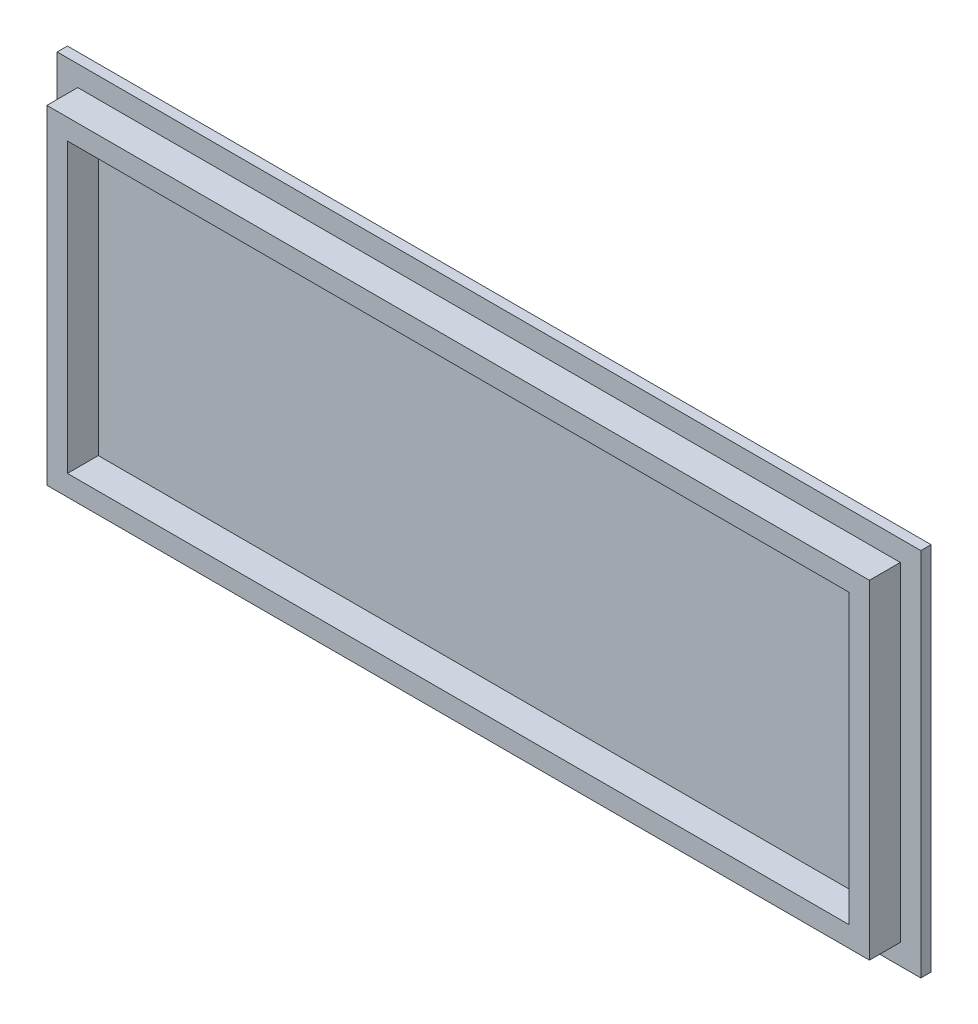
from build123d import *

# Parameters (mm, degrees)
SKETCH1_W           = 84
SKETCH1_H           = 36
BOSS_EXTRUDE1_DEPTH = 1
SKETCH2_W           = 80
SKETCH2_H           = 32
SKETCH2_W_2         = 76
SKETCH2_H_2         = 28
BOSS_EXTRUDE2_DEPTH = 3


with BuildPart() as part:
    # Sketch1 → Boss-Extrude1 (new body)
    with BuildSketch(Plane.XY):
        with Locations((42, 18)):
            Rectangle(SKETCH1_W, SKETCH1_H)
    extrude(amount=BOSS_EXTRUDE1_DEPTH)

    # Sketch2 → Boss-Extrude2 (add)
    with BuildSketch(Plane.XY.offset(1)):
        with Locations((42, 18)):
            Rectangle(SKETCH2_W, SKETCH2_H)
        with Locations((42, 18)):
            Rectangle(SKETCH2_W_2, SKETCH2_H_2, mode=Mode.SUBTRACT)
    extrude(amount=BOSS_EXTRUDE2_DEPTH)


solid = part.part
